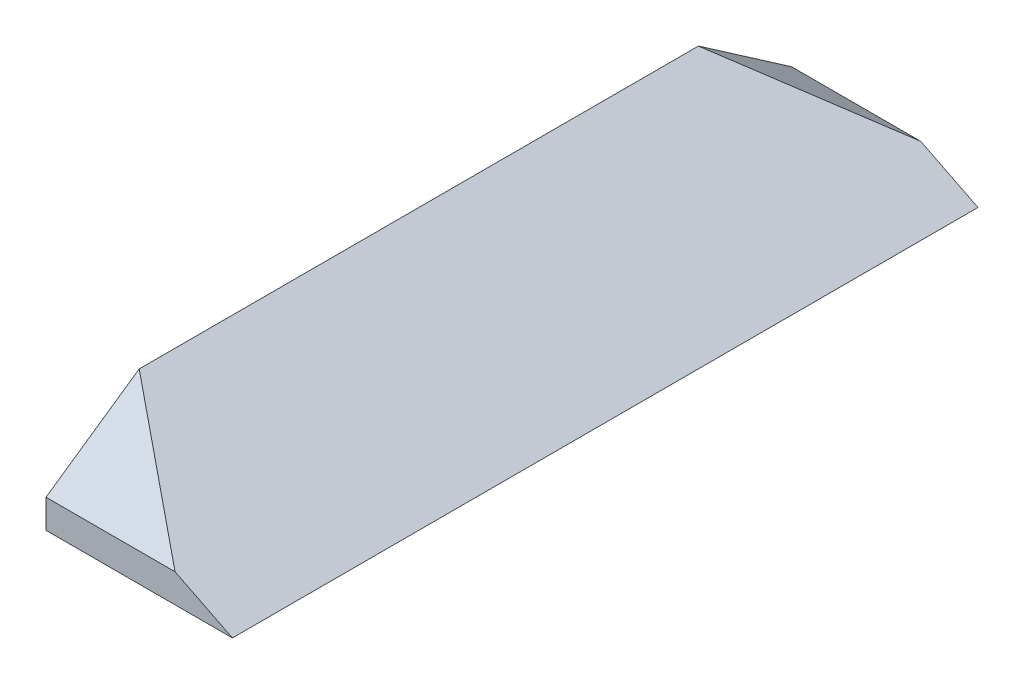
from build123d import *

# Parameters (mm, degrees)
BOSS_EXTRUDE1_DEPTH = 40
CUT_EXTRUDE1_DEPTH  = 30


with BuildPart() as part:
    # Sketch1 → Boss-Extrude1 (new body)
    with BuildSketch(Plane.XY):
        Polygon((0, 0), (10, 0), (0, 5), align=None)
    extrude(amount=BOSS_EXTRUDE1_DEPTH)

    # Sketch3 → Cut-Extrude1 (cut)
    with BuildSketch(Plane.ZY):
        Polygon((5, 5), (0, 1.537620853), (0, 5), align=None)
        Polygon((35, 5), (40, 5), (40, 1.537620853), align=None)
    extrude(amount=-CUT_EXTRUDE1_DEPTH, mode=Mode.SUBTRACT)


solid = part.part
